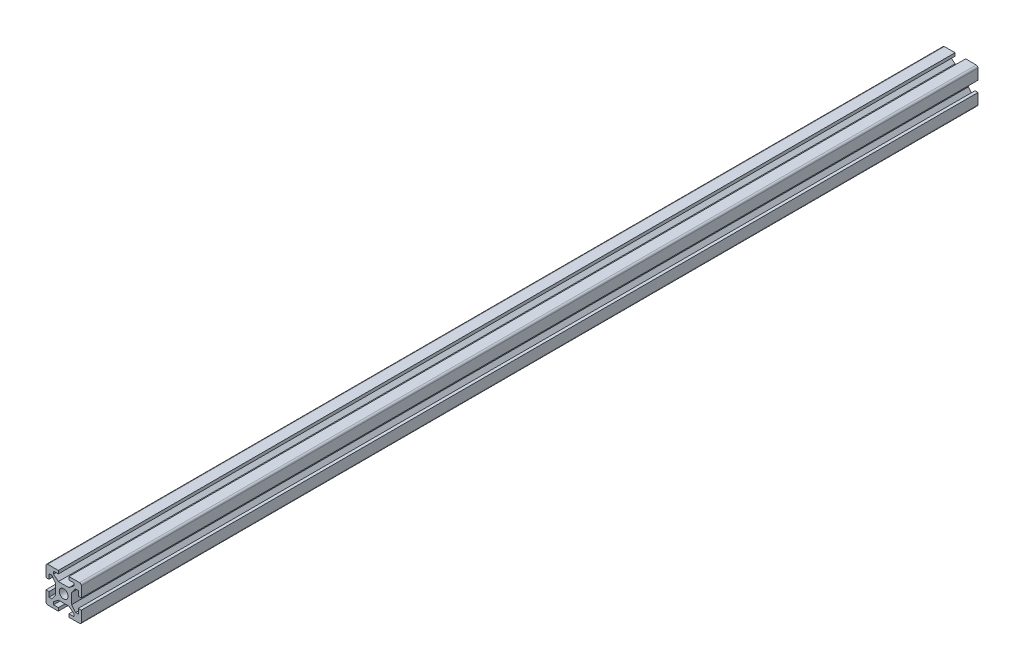
from build123d import *

# Parameters (mm, degrees)
BOSS_EXTRUDE1_DEPTH     = 254
CUT_EXTRUDE1_DEPTH      = 509.196812269
CUT_EXTRUDE1_DEPTH_BACK = 509.196812269
SKETCH2_R               = 2.5
FILLET1_R               = 1
FILLET2_R               = 1


with BuildPart() as part:
    # Sketch1 → Boss-Extrude1 (new, symmetric)
    with BuildSketch(Plane.XY):
        Polygon((-10, 10), (-3, 10), (-3, 8.272610059), (-5.783778863, 8.272610059), (-5.783778863, 6.747994248), (-3, 4.550753814), (3, 4.550753814), (5.783778863, 6.747994248), (5.783778863, 8.272610059), (3, 8.272610059), (3, 10), (10, 10), (10, 3), (8.272610059, 3), (8.272610059, 5.783778863), (6.747994248, 5.783778863), (4.55, 3.000595152), (4.55, -2.999404848), (6.747994248, -5.783778863), (8.272610059, -5.783778863), (8.272610059, -3), (10, -3), (10, -10), (3, -10), (3, -8.272610059), (5.783778863, -8.272610059), (5.783778863, -6.747994248), (2.999404848, -4.55), (-3.000595152, -4.55), (-5.783778863, -6.747994248), (-5.783778863, -8.272610059), (-3, -8.272610059), (-3, -10), (-10, -10), (-10, -3), (-8.272610059, -3), (-8.272610059, -5.783778863), (-6.747994248, -5.783778863), (-4.55, -3.000595152), (-4.55, 2.999404848), (-6.747994248, 5.783778863), (-8.272610059, 5.783778863), (-8.272610059, 3), (-10, 3), align=None)
    extrude(amount=BOSS_EXTRUDE1_DEPTH, both=True)

    # Sketch2 → Cut-Extrude1 (cut, two sides: drawn at the far end of the back side and taken through both)
    with BuildSketch(Plane.XY.offset(254).offset(-CUT_EXTRUDE1_DEPTH_BACK)):
        Circle(SKETCH2_R)
    extrude(amount=CUT_EXTRUDE1_DEPTH + CUT_EXTRUDE1_DEPTH_BACK, mode=Mode.SUBTRACT)

    # Fillet1
    fillet1_edges = [part.edges().sort_by_distance(p)[0] for p in [
        (10, 10, 0),
    ]]
    fillet(fillet1_edges, radius=FILLET1_R)

    # Fillet2
    fillet2_edges = [part.edges().sort_by_distance(p)[0] for p in [
        (-10, 10, 0),
        (10, -10, 0),
        (-10, -10, 0),
    ]]
    fillet(fillet2_edges, radius=FILLET2_R)


solid = part.part
